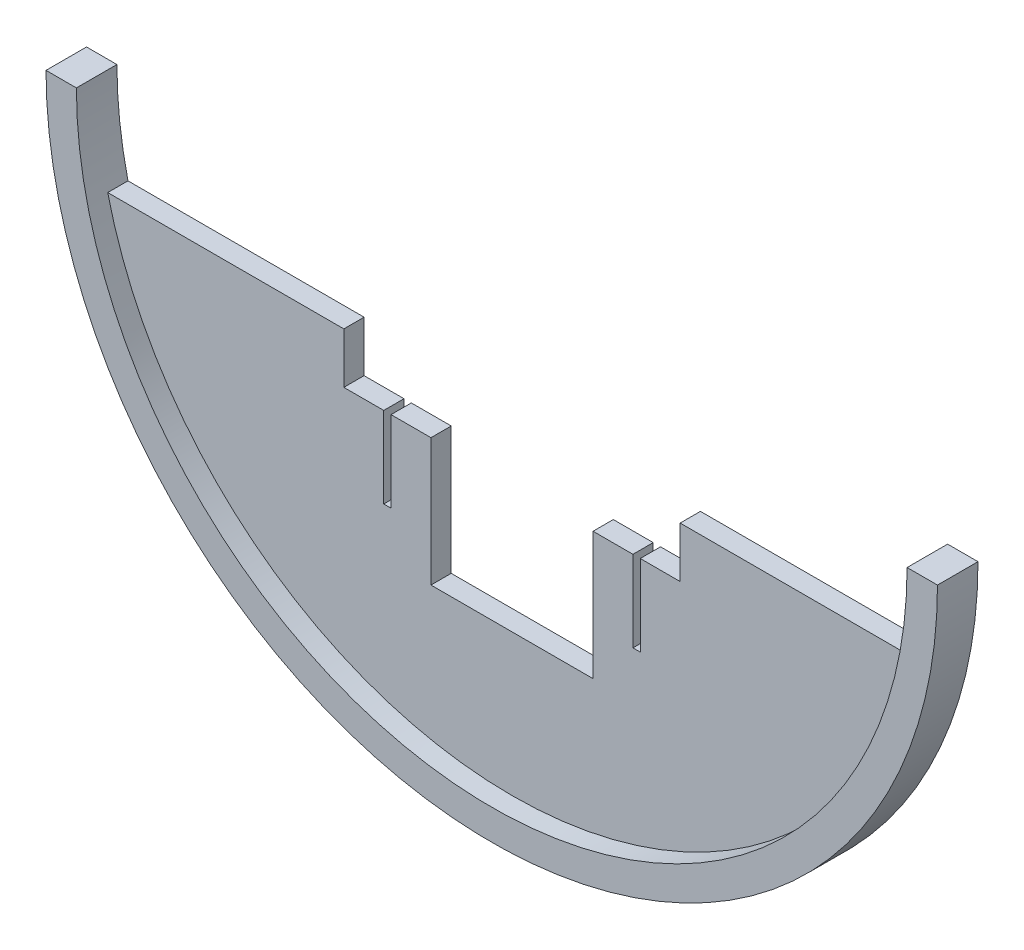
from build123d import *

# Parameters (mm, degrees)
BOSS_EXTRUDE1_DEPTH = 20
CUT_EXTRUDE2_START  = -10
CUT_EXTRUDE2_DEPTH  = 10


with BuildPart() as part:
    # Sketch1 → Boss-Extrude1 (new body)
    with BuildSketch(Plane.XY):
        with BuildLine():
            Line((106.370051436, 5.820149254), (-10.169418344, 5.820149254))
            ThreePointArc((-10.169418344, 5.820149254), (-14.260240152, 29.162077744), (-15.629948564, 52.820149254))
            Line((-15.629948564, 52.820149254), (-30.629948564, 52.820149254))
            ThreePointArc((-30.629948564, 52.820149254), (189.370051436, -167.179850746), (409.370051436, 52.820149254))
            Line((409.370051436, 52.820149254), (394.370051436, 52.820149254))
            ThreePointArc((394.370051436, 52.820149254), (393.000343025, 29.162077744), (388.909521216, 5.820149254))
            Line((388.909521216, 5.820149254), (272.370051436, 5.820149254))
            Line((272.370051436, 5.820149254), (272.370051436, -19.179850746))
            Line((272.370051436, -19.179850746), (252.670051436, -19.179850746))
            Line((252.670051436, -19.179850746), (252.670051436, -59.179850746))
            Line((252.670051436, -59.179850746), (249.070051436, -59.179850746))
            Line((249.070051436, -59.179850746), (249.070051436, -19.179850746))
            Line((249.070051436, -19.179850746), (229.370051436, -19.179850746))
            Line((229.370051436, -19.179850746), (229.370051436, -82.179850746))
            Line((229.370051436, -82.179850746), (149.370051436, -82.179850746))
            Line((149.370051436, -82.179850746), (149.370051436, -19.179850746))
            Line((149.370051436, -19.179850746), (129.670051436, -19.179850746))
            Line((129.670051436, -19.179850746), (129.670051436, -59.179850746))
            Line((129.670051436, -59.179850746), (126.070051436, -59.179850746))
            Line((126.070051436, -59.179850746), (126.070051436, -19.179850746))
            Line((126.070051436, -19.179850746), (106.370051436, -19.179850746))
            Line((106.370051436, -19.179850746), (106.370051436, 5.820149254))
        make_face()
    extrude(amount=BOSS_EXTRUDE1_DEPTH)

    # Sketch2 → Cut-Extrude2 (cut)
    with BuildSketch(Plane.XY.offset(20).offset(CUT_EXTRUDE2_START)):
        with BuildLine():
            Line((-10.169418344, 5.820149254), (106.370051436, 5.820149254))
            Line((106.370051436, 5.820149254), (106.370051436, -19.179850746))
            Line((106.370051436, -19.179850746), (126.070051436, -19.179850746))
            Line((126.070051436, -19.179850746), (126.070051436, -59.179850746))
            Line((126.070051436, -59.179850746), (129.670051436, -59.179850746))
            Line((129.670051436, -59.179850746), (129.670051436, -19.179850746))
            Line((129.670051436, -19.179850746), (149.370051436, -19.179850746))
            Line((149.370051436, -19.179850746), (149.370051436, -82.179850746))
            Line((149.370051436, -82.179850746), (229.370051436, -82.179850746))
            Line((229.370051436, -82.179850746), (229.370051436, -19.179850746))
            Line((229.370051436, -19.179850746), (249.070051436, -19.179850746))
            Line((249.070051436, -19.179850746), (249.070051436, -59.179850746))
            Line((249.070051436, -59.179850746), (252.670051436, -59.179850746))
            Line((252.670051436, -59.179850746), (252.670051436, -19.179850746))
            Line((252.670051436, -19.179850746), (272.370051436, -19.179850746))
            Line((272.370051436, -19.179850746), (272.370051436, 5.820149254))
            Line((272.370051436, 5.820149254), (388.909521216, 5.820149254))
            ThreePointArc((388.909521216, 5.820149254), (189.370051436, -152.179850746), (-10.169418344, 5.820149254))
        make_face()
    extrude(amount=CUT_EXTRUDE2_DEPTH, mode=Mode.SUBTRACT)


solid = part.part
